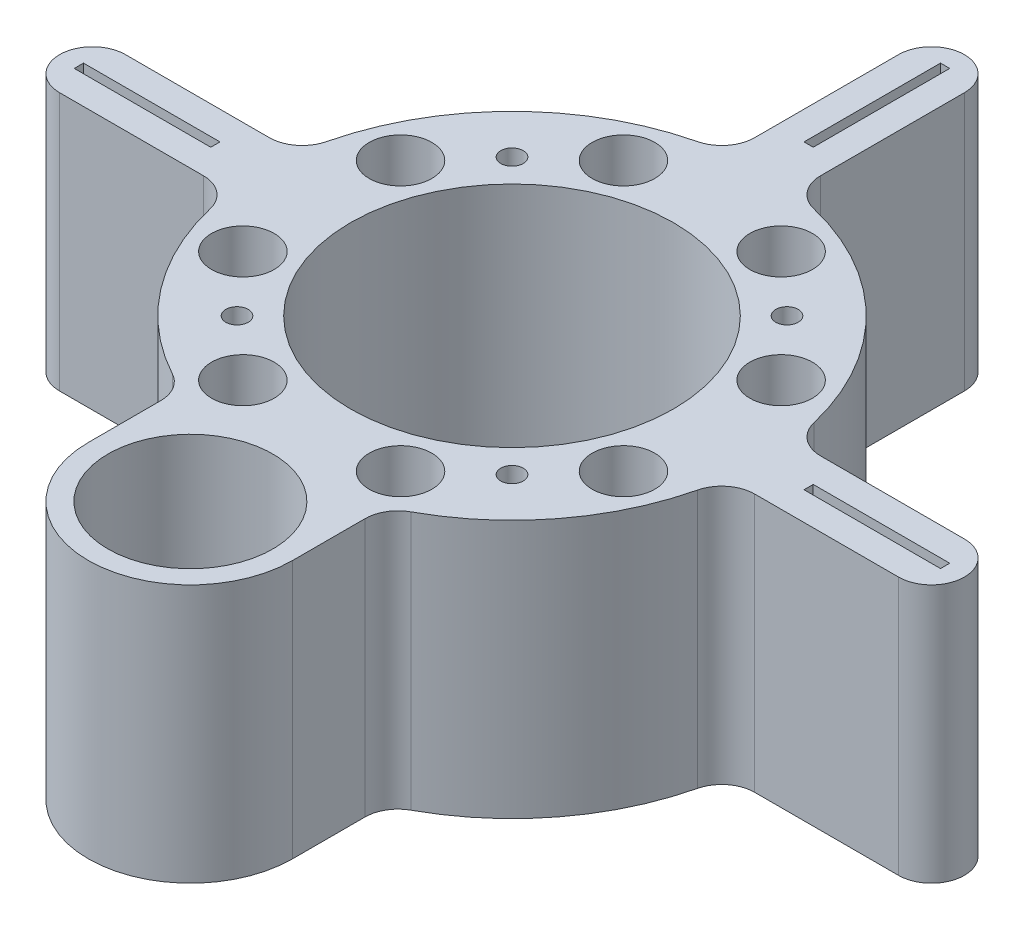
from build123d import *

# Parameters (mm, degrees)
BOSS_EXTRU_1_DEPTH      = 39.2
ESQUISSE2_W             = 20.710678119
ESQUISSE2_H             = 1.4
ESQUISSE2_W_2           = 1.4
ESQUISSE2_H_2           = 20.710678119
ENL_V_MAT_EXTRU_1_DEPTH = 15
ESQUISSE3_R             = 1.7
ENL_V_MAT_EXTRU_2_DEPTH = 108.408751971
ENL_V_START             = -5
ESQUISSE4_R             = 3.5
ENL_V_MAT_EXTRU_3_DEPTH = 103.408751971
ESQUISSE5_R             = 1.25
ENL_V_MAT_EXTRU_4_DEPTH = 103.408751971
ESQUISSE6_R             = 12.5
ENL_V_MAT_EXTRU_5_DEPTH = 108.408751971
ESQUISSE7_OUTSIDE_W     = 184.184
ESQUISSE7_OUTSIDE_H     = 184.184
ESQUISSE7_OUTSIDE_R     = 24.5
ESQUISSE7_OUTSIDE_R_2   = 4.75
ENL_V_MAT_EXTRU_6_DEPTH = 108.408751971


with BuildPart() as part:
    # Esquisse1 → Boss.-Extru.1 (new body)
    with BuildSketch(Plane(origin=(0, 0, 0), x_dir=(1, 0, 0), z_dir=(0, 1, 0))):
        Polygon((0, 70.710678119), (70.710678119, 0), (0, -70.710678119), (-70.710678119, 0), align=None)
    extrude(amount=BOSS_EXTRU_1_DEPTH)

    # Esquisse2 → Enlèv. mat.-Extru.1 (cut)
    with BuildSketch(Plane(origin=(0, 39.2, 0), x_dir=(1, 0, 0), z_dir=(0, 1, 0))):
        with Locations((55.35533906, 0)):
            Rectangle(ESQUISSE2_W, ESQUISSE2_H)
        with Locations((0, 55.35533906)):
            Rectangle(ESQUISSE2_W_2, ESQUISSE2_H_2)
        with Locations((-55.35533906, 0)):
            Rectangle(ESQUISSE2_W, ESQUISSE2_H)
    extrude(amount=-ENL_V_MAT_EXTRU_1_DEPTH, mode=Mode.SUBTRACT)

    # Esquisse3 → Enlèv. mat.-Extru.2 (cut, through all)
    with BuildSketch(Plane(origin=(0, 39.2, 0), x_dir=(1, 0, 0), z_dir=(0, 1, 0))):
        with Locations(Location((20.859650045, 20.859650045, 0), (0, 0, 270))):
            Circle(ESQUISSE3_R)
        with Locations(Location((20.859650045, -20.859650045, 0), (0, 0, 270))):
            Circle(ESQUISSE3_R)
        with Locations(Location((-20.859650045, 20.859650045, 0), (0, 0, 270))):
            Circle(ESQUISSE3_R)
        with Locations(Location((-20.859650045, -20.859650045, 0), (0, 0, 270))):
            Circle(ESQUISSE3_R)
    extrude(amount=-ENL_V_MAT_EXTRU_2_DEPTH, mode=Mode.SUBTRACT)

    # Esquisse4 → Enlèv. mat.-Extru.3 (cut, through all)
    with BuildSketch(Plane(origin=(0, 39.2, 0), x_dir=(1, 0, 0), z_dir=(0, 1, 0)).offset(ENL_V_START)):
        with Locations(Location((20.859650045, 20.859650045, 0), (0, 0, 270))):
            Circle(ESQUISSE4_R)
        with Locations(Location((20.859650045, -20.859650045, 0), (0, 0, 270))):
            Circle(ESQUISSE4_R)
        with Locations(Location((-20.859650045, 20.859650045, 0), (0, 0, 270))):
            Circle(ESQUISSE4_R)
        with Locations(Location((-20.859650045, -20.859650045, 0), (0, 0, 270))):
            Circle(ESQUISSE4_R)
    extrude(amount=-ENL_V_MAT_EXTRU_3_DEPTH, mode=Mode.SUBTRACT)

    # Esquisse5 → Enlèv. mat.-Extru.4 (cut, through all)
    with BuildSketch(Plane(origin=(0, 39.2, 0), x_dir=(1, 0, 0), z_dir=(0, 1, 0)).offset(ENL_V_START)):
        with Locations(Location((29.5, 0, 0), (0, 0, 270))):
            Circle(ESQUISSE5_R)
        with Locations(Location((-29.5, 0, 0), (0, 0, 270))):
            Circle(ESQUISSE5_R)
        with Locations(Location((0, -29.5, 0), (0, 0, 270))):
            Circle(ESQUISSE5_R)
        with Locations(Location((0, 29.5, 0), (0, 0, 270))):
            Circle(ESQUISSE5_R)
    extrude(amount=-ENL_V_MAT_EXTRU_4_DEPTH, mode=Mode.SUBTRACT)

    # Esquisse6 → Enlèv. mat.-Extru.5 (cut, through all)
    with BuildSketch(Plane(origin=(0, 39.2, 0), x_dir=(1, 0, 0), z_dir=(0, 1, 0))):
        with Locations(Location((0, -48.790367902, 0), (0, 0, 270))):
            Circle(ESQUISSE6_R)
    extrude(amount=-ENL_V_MAT_EXTRU_5_DEPTH, mode=Mode.SUBTRACT)

    # Esquisse7 outside → Enlèv. mat.-Extru.6 (cut, through all)
    # profile 1 of 10: a face of its own
    with BuildSketch(Plane(origin=(0, 39.2, 0), x_dir=(1, 0, 0), z_dir=(0, 1, 0))):
        Rectangle(ESQUISSE7_OUTSIDE_W, ESQUISSE7_OUTSIDE_H)
        with BuildLine():
            Line((5, 41.821047333), (5, 63.639610307))
            ThreePointArc((5, 63.639610307), (0, 68.639610307), (-5, 63.639610307))
            Line((-5, 63.639610307), (-5, 41.821047333))
            ThreePointArc((-5, 41.821047333), (-6.074827807, 38.723786728), (-8.837209302, 36.958134852))
            ThreePointArc((-8.837209302, 36.958134852), (-26.870057685, 26.870057685), (-36.958134852, 8.837209302))
            ThreePointArc((-36.958134852, 8.837209302), (-38.723786728, 6.074827807), (-41.821047333, 5))
            Line((-41.821047333, 5), (-63.639610307, 5))
            ThreePointArc((-63.639610307, 5), (-68.639610307, 0), (-63.639610307, -5))
            Line((-63.639610307, -5), (-41.821047333, -5))
            ThreePointArc((-41.821047333, -5), (-38.723786728, -6.074827807), (-36.958134852, -8.837209302))
            ThreePointArc((-36.958134852, -8.837209302), (-30.152523014, -23.126291443), (-18.11627907, -33.403599097))
            ThreePointArc((-18.11627907, -33.403599097), (-16.20357098, -35.241330732), (-15.5, -37.798809505))
            Line((-15.5, -37.798809505), (-15.5, -48.790367902))
            ThreePointArc((-15.5, -48.790367902), (0, -64.290367902), (15.5, -48.790367902))
            Line((15.5, -48.790367902), (15.5, -37.798809505))
            ThreePointArc((15.5, -37.798809505), (16.20357098, -35.241330732), (18.11627907, -33.403599097))
            ThreePointArc((18.11627907, -33.403599097), (30.152523014, -23.126291443), (36.958134852, -8.837209302))
            ThreePointArc((36.958134852, -8.837209302), (38.723786728, -6.074827807), (41.821047333, -5))
            Line((41.821047333, -5), (63.639610307, -5))
            ThreePointArc((63.639610307, -5), (68.639610307, 0), (63.639610307, 5))
            Line((63.639610307, 5), (41.821047333, 5))
            ThreePointArc((41.821047333, 5), (38.723786728, 6.074827807), (36.958134852, 8.837209302))
            ThreePointArc((36.958134852, 8.837209302), (26.870057685, 26.870057685), (8.837209302, 36.958134852))
            ThreePointArc((8.837209302, 36.958134852), (6.074827807, 38.723786728), (5, 41.821047333))
        make_face(mode=Mode.SUBTRACT)
    # profile 2 of 10: a face of its own
    with BuildSketch(Plane(origin=(0, 39.2, 0), x_dir=(1, 0, 0), z_dir=(0, 1, 0))):
        with Locations(Location((0, 0, 0), (0, 0, 270))):
            Circle(ESQUISSE7_OUTSIDE_R)
    # profile 3 of 10: a face of its own
    with BuildSketch(Plane(origin=(0, 39.2, 0), x_dir=(1, 0, 0), z_dir=(0, 1, 0))):
        with Locations(Location((11.958857261, 28.871235391, 0), (0, 0, 270))):
            Circle(ESQUISSE7_OUTSIDE_R_2)
    # profile 4 of 10: a face of its own
    with BuildSketch(Plane(origin=(0, 39.2, 0), x_dir=(1, 0, 0), z_dir=(0, 1, 0))):
        with Locations(Location((28.871235391, 11.958857261, 0), (0, 0, 270))):
            Circle(ESQUISSE7_OUTSIDE_R_2)
    # profile 5 of 10: a face of its own
    with BuildSketch(Plane(origin=(0, 39.2, 0), x_dir=(1, 0, 0), z_dir=(0, 1, 0))):
        with Locations(Location((28.871235391, -11.958857261, 0), (0, 0, 270))):
            Circle(ESQUISSE7_OUTSIDE_R_2)
    # profile 6 of 10: a face of its own
    with BuildSketch(Plane(origin=(0, 39.2, 0), x_dir=(1, 0, 0), z_dir=(0, 1, 0))):
        with Locations(Location((11.958857261, -28.871235391, 0), (0, 0, 270))):
            Circle(ESQUISSE7_OUTSIDE_R_2)
    # profile 7 of 10: a face of its own
    with BuildSketch(Plane(origin=(0, 39.2, 0), x_dir=(1, 0, 0), z_dir=(0, 1, 0))):
        with Locations(Location((-11.958857261, -28.871235391, 0), (0, 0, 270))):
            Circle(ESQUISSE7_OUTSIDE_R_2)
    # profile 8 of 10: a face of its own
    with BuildSketch(Plane(origin=(0, 39.2, 0), x_dir=(1, 0, 0), z_dir=(0, 1, 0))):
        with Locations(Location((-28.871235391, -11.958857261, 0), (0, 0, 270))):
            Circle(ESQUISSE7_OUTSIDE_R_2)
    # profile 9 of 10: a face of its own
    with BuildSketch(Plane(origin=(0, 39.2, 0), x_dir=(1, 0, 0), z_dir=(0, 1, 0))):
        with Locations(Location((-28.871235391, 11.958857261, 0), (0, 0, 270))):
            Circle(ESQUISSE7_OUTSIDE_R_2)
    # profile 10 of 10: a face of its own
    with BuildSketch(Plane(origin=(0, 39.2, 0), x_dir=(1, 0, 0), z_dir=(0, 1, 0))):
        with Locations(Location((-11.958857261, 28.871235391, 0), (0, 0, 270))):
            Circle(ESQUISSE7_OUTSIDE_R_2)
    extrude(amount=-ENL_V_MAT_EXTRU_6_DEPTH, mode=Mode.SUBTRACT)


solid = part.part
